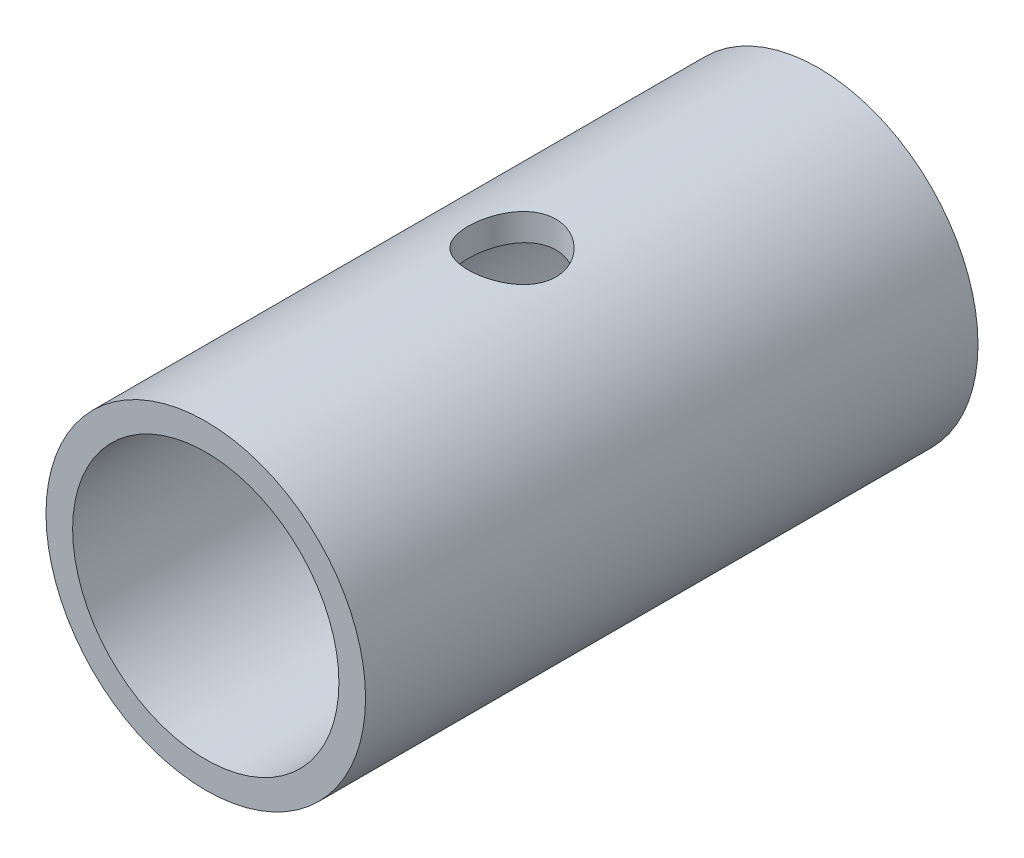
from build123d import *

# Parameters (mm, degrees)
SKETCH1_R               = 6
SKETCH1_R_2             = 5
BOSS_EXTRUDE2_DEPTH     = 11.5
CUT_EXTRUDE1_REACH      = 19.671
CUT_EXTRUDE1_END_RADIUS = 5
SKETCH2_R               = 1.65


with BuildPart() as part:
    # Sketch1 → Boss-Extrude2 (new, symmetric)
    with BuildSketch(Plane.XY):
        Circle(SKETCH1_R)
        Circle(SKETCH1_R_2, mode=Mode.SUBTRACT)
    extrude(amount=BOSS_EXTRUDE2_DEPTH, both=True)

    # Cut-Extrude1: up to this cylinder (the profile starts outside it)
    cut_extrude1_end = Plane(origin=(0, 0, 0), z_dir=(0, 0, -1)) * Cylinder(CUT_EXTRUDE1_END_RADIUS, 50.342, mode=Mode.PRIVATE)
    # Sketch2 → Cut-Extrude1 (cut, up to the surface)
    with BuildSketch(Plane(origin=(0, 6, 0), x_dir=(1, 0, 0), z_dir=(0, 1, 0)), mode=Mode.PRIVATE) as cut_extrude1_sk1:
        with Locations(Location((0, 0, 0), (0, 0, 270))):
            Circle(SKETCH2_R)
    cut_extrude1_tool1 = extrude(cut_extrude1_sk1.sketch, amount=-CUT_EXTRUDE1_REACH, mode=Mode.PRIVATE) - cut_extrude1_end
    add(cut_extrude1_tool1.solids().sort_by_distance((0, 6, 0))[0], mode=Mode.SUBTRACT)


solid = part.part
